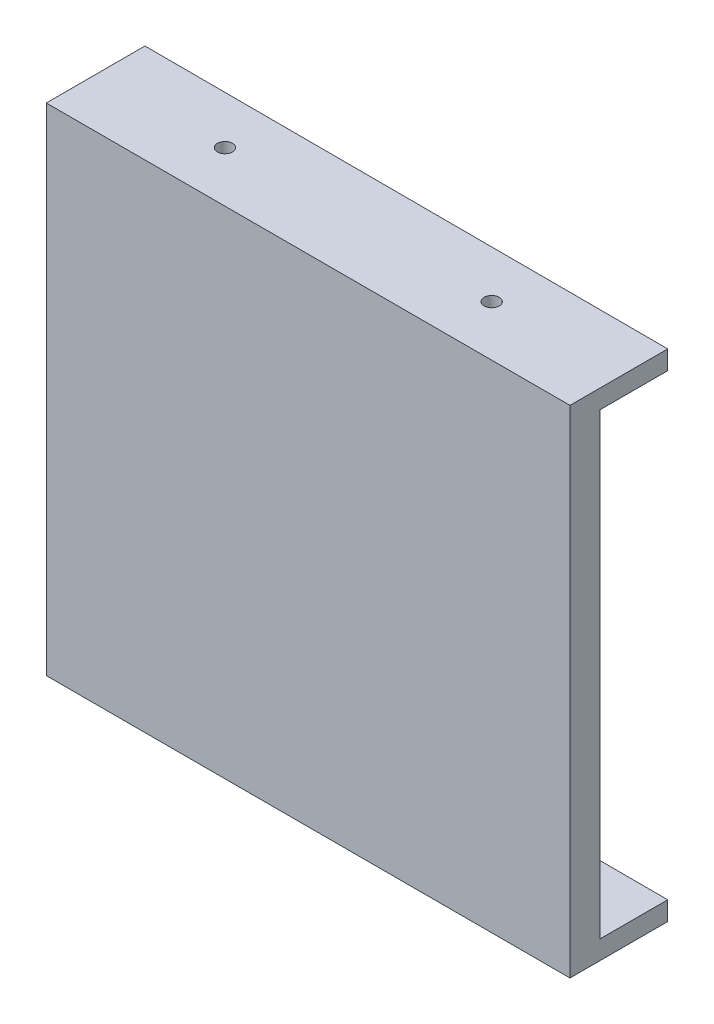
from build123d import *

# Parameters (mm, degrees)
SKETCH1_W           = 138.84292961
SKETCH1_H           = 131.475201729
BOSS_EXTRUDE1_DEPTH = 8
BOSS_EXTRUDE2_REACH = 234.154
SKETCH3_W           = 138.84292961
SKETCH3_H           = 5
CUT_EXTRUDE1_REACH  = 235.486
SKETCH5_R           = 2
CUT_EXTRUDE2_DEPTH  = 234.486082153


with BuildPart() as part:
    # Sketch1 → Boss-Extrude1 (new body)
    with BuildSketch(Plane.XY):
        with Locations((121.747366115, -65.737600865)):
            Rectangle(SKETCH1_W, SKETCH1_H)
    extrude(amount=-BOSS_EXTRUDE1_DEPTH)

    # Boss-Extrude2: up to this plane
    boss_extrude2_end = Plane(origin=(52.32590131, -131.475201729, -26.162950407), z_dir=(-0.001800589328445012, 0, 0.9999983789377211))
    # Sketch3 → Boss-Extrude2 (add, up to the surface)
    with BuildSketch(Plane.XY, mode=Mode.PRIVATE) as boss_extrude2_sk1:
        with Locations((121.747366115, -2.5)):
            Rectangle(SKETCH3_W, SKETCH3_H)
    boss_extrude2_tool1 = split(extrude(boss_extrude2_sk1.sketch, amount=-BOSS_EXTRUDE2_REACH, mode=Mode.PRIVATE), bisect_by=boss_extrude2_end, keep=Keep.BOTH, mode=Mode.PRIVATE)
    add(boss_extrude2_tool1.solids().sort_by_distance((121.747366, -2.5, 0))[0])
    # Sketch3 → Boss-Extrude2 (add, up to the surface)
    with BuildSketch(Plane.XY, mode=Mode.PRIVATE) as boss_extrude2_sk2:
        with Locations((121.747366115, -128.975201729)):
            Rectangle(SKETCH3_W, SKETCH3_H)
    boss_extrude2_tool2 = split(extrude(boss_extrude2_sk2.sketch, amount=-BOSS_EXTRUDE2_REACH, mode=Mode.PRIVATE), bisect_by=boss_extrude2_end, keep=Keep.BOTH, mode=Mode.PRIVATE)
    add(boss_extrude2_tool2.solids().sort_by_distance((121.747366, -128.975202, 0))[0])

    # Sketch4 → Cut-Extrude1 (cut, up to next)
    with BuildSketch(Plane.XZ.offset(131.475201729), mode=Mode.PRIVATE) as cut_extrude1_sk1:
        Polygon((135.612712051, -26.012984821), (128.698898599, -14.037908649), (114.842492139, -14.037908649), (108.015470014, -26.062676201), align=None)
    cut_extrude1_tool1 = extrude(cut_extrude1_sk1.sketch, amount=-CUT_EXTRUDE1_REACH, mode=Mode.PRIVATE) & part.part
    add(cut_extrude1_tool1.solids().sort_by_distance((121.790009, -131.475202, -20.700826))[0], mode=Mode.SUBTRACT)

    # Sketch5 → Cut-Extrude2 (cut, through all)
    with BuildSketch(Plane.XZ.offset(131.475201729)):
        with Locations(Location((86.267027305, -13.435028843, 0), (0, 0, 270))):
            Circle(SKETCH5_R)
        with Locations(Location((156.977705423, -13.435028843, 0), (0, 0, 270))):
            Circle(SKETCH5_R)
    extrude(amount=-CUT_EXTRUDE2_DEPTH, mode=Mode.SUBTRACT)


solid = part.part
